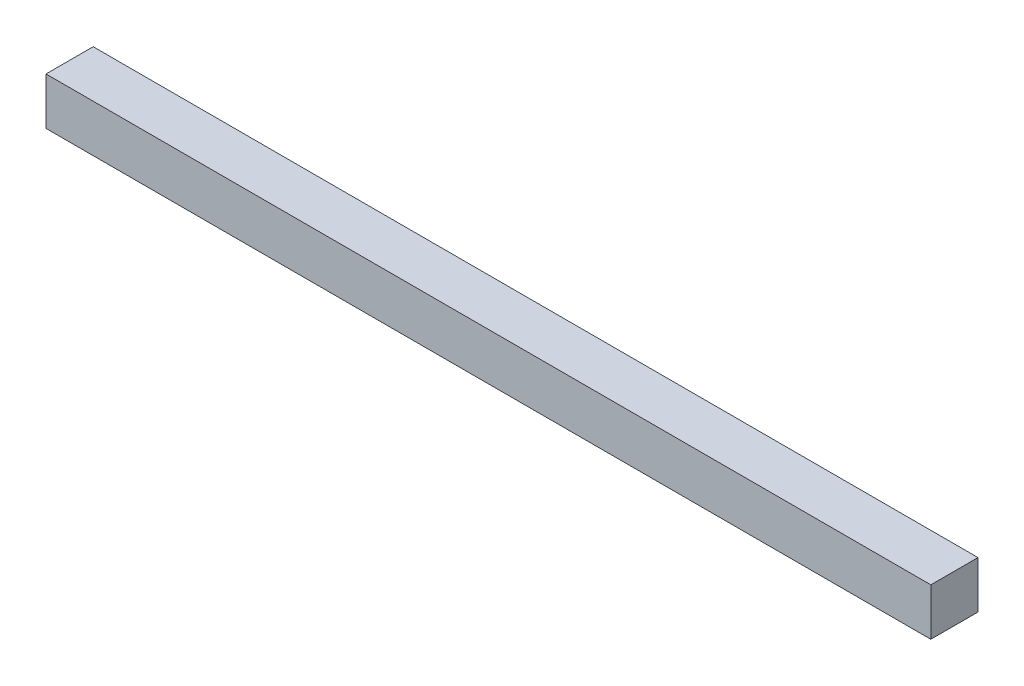
from build123d import *

# Parameters (mm, degrees)
SKETCH1_W           = 75
SKETCH1_H           = 4
BOSS_EXTRUDE1_DEPTH = 4


with BuildPart() as part:
    # Sketch1 → Boss-Extrude1 (new body)
    with BuildSketch(Plane(origin=(0, 0, 0), x_dir=(1, 0, 0), z_dir=(0, 1, 0))):
        with Locations((37.5, -2)):
            Rectangle(SKETCH1_W, SKETCH1_H)
    extrude(amount=BOSS_EXTRUDE1_DEPTH)


solid = part.part
